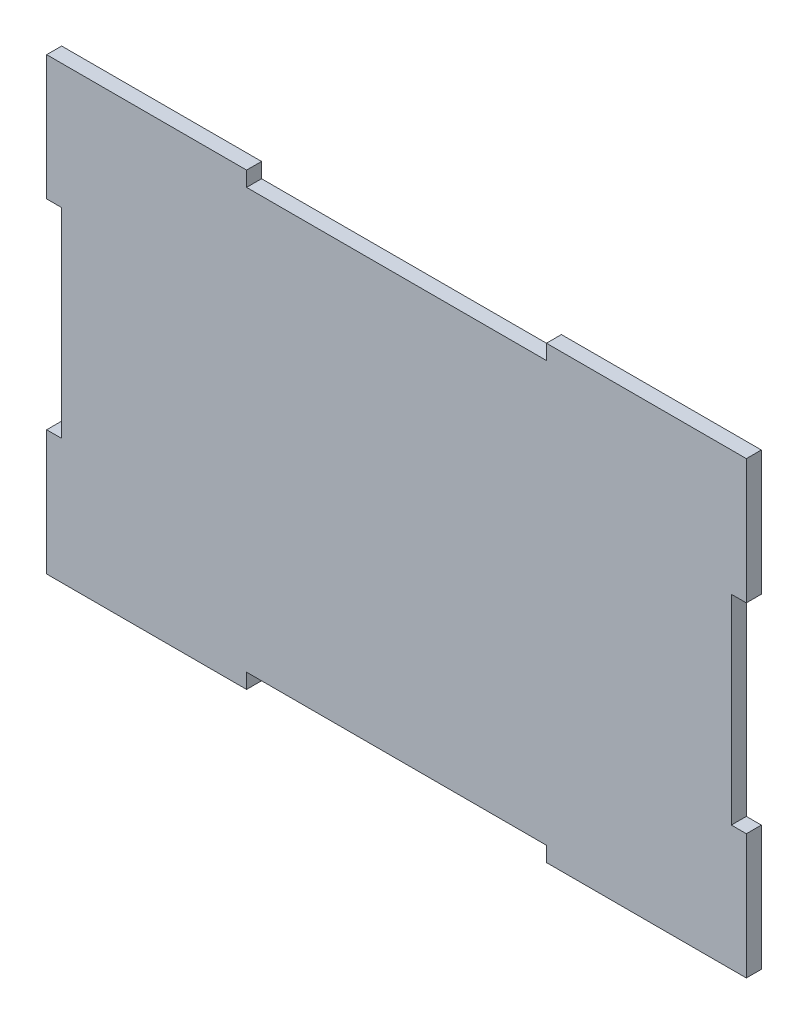
from build123d import *

# Parameters (mm, degrees)
EXTRUDE_1_DEPTH = 3


with BuildPart() as part:
    # Эскиз1 → Бобышка-Вытянуть1 (new body)
    with BuildSketch(Plane.XY):
        Polygon((0, 0), (40, 0), (40, 3), (100, 3), (100, 0), (140, 0), (140, 25), (137, 25), (137, 65), (140, 65), (140, 90), (100, 90), (100, 87), (40, 87), (40, 90), (0, 90), (0, 65), (3, 65), (3, 25), (0, 25), align=None)
    extrude(amount=EXTRUDE_1_DEPTH)


solid = part.part
